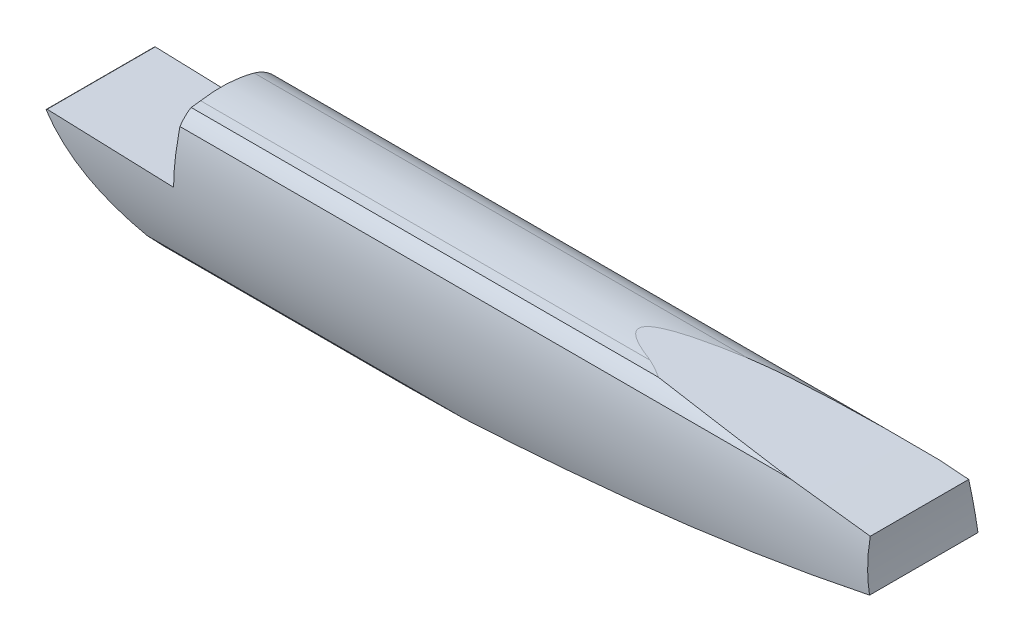
from build123d import *

# Parameters (mm, degrees)
BOSS_EXTRUDE1_DEPTH     = 100
CUT_EXTRUDE3_DEPTH      = 554.165701555
CUT_EXTRUDE3_DEPTH_BACK = 554.165701555
CUT_EXTRUDE5_DEPTH      = 553.962044682
CUT_EXTRUDE5_DEPTH_BACK = 553.962044682
CUT_EXTRUDE7_DEPTH      = 553.962044682
CUT_EXTRUDE7_DEPTH_BACK = 553.962044682


with BuildPart() as part:
    # Sketch1 → Boss-Extrude1 (new body)
    with BuildSketch(Plane.XY):
        with BuildLine():
            ThreePointArc((-192.629438793, 0), (-136.135725272, 33.719619965), (-73.991525193, 55.321722514))
            ThreePointArc((-73.991525193, 55.321722514), (231.264395529, 54.89097703), (535.785554592, 33.719619965))
            ThreePointArc((535.785554592, 33.719619965), (536.798211586, 12.89819156), (539.317827414, -7.795017256))
            ThreePointArc((539.317827414, -7.795017256), (238.042039648, -55.533392614), (-66.568309368, -71.614065728))
            ThreePointArc((-66.568309368, -71.614065728), (-137.800866021, -50.244872094), (-192.629438793, 0))
        make_face()
    extrude(amount=BOSS_EXTRUDE1_DEPTH)

    # Sketch2 → Cut-Extrude3 (cut, two sides: drawn at the far end of the back side and taken through both)
    with BuildSketch(Plane(origin=(0, 0, 0), x_dir=(0, 0, -1), z_dir=(1, 0, 0)).offset(-CUT_EXTRUDE3_DEPTH_BACK)):
        with BuildLine():
            ThreePointArc((-65.447202994, 54.830423707), (-80.892507985, 50.983746932), (-92.956496986, 40.600368972))
            ThreePointArc((-92.956496986, 40.600368972), (-98.736407831, -10.977338679), (-88.967303886, -61.950193259))
            ThreePointArc((-88.967303886, -61.950193259), (-83.10915251, -68.165990231), (-75.589128758, -72.216090516))
            ThreePointArc((-75.589128758, -72.216090516), (-123.822815089, -94.064788666), (-173.378544397, -75.407784602))
            ThreePointArc((-173.378544397, -75.407784602), (-163.802190068, -4.583325871), (-135.262897635, 60.940099743))
            ThreePointArc((-135.262897635, 60.940099743), (-100.366866686, 80.430667917), (-61.326949176, 89.003885783))
            ThreePointArc((-61.326949176, 89.003885783), (-63.560434952, 71.938056418), (-65.447202994, 54.830423707))
        make_face()
    extrude(amount=CUT_EXTRUDE3_DEPTH + CUT_EXTRUDE3_DEPTH_BACK, mode=Mode.SUBTRACT)

    # Sketch3 → Cut-Extrude5 (cut, two sides: drawn at the far end of the back side and taken through both)
    with BuildSketch(Plane(origin=(0, 0, 0), x_dir=(0, 0, -1), z_dir=(1, 0, 0)).offset(-CUT_EXTRUDE5_DEPTH_BACK)):
        with BuildLine():
            ThreePointArc((-74.208303325, 50.886642831), (-50.335012976, 52.211638999), (-26.713093985, 48.511024166))
            ThreePointArc((-26.713093985, 48.511024166), (-16.247111553, 43.841102683), (-7.714956491, 36.189482926))
            ThreePointArc((-7.714956491, 36.189482926), (-2.445034952, -12.786836037), (-8.678058045, -61.649923489))
            ThreePointArc((-8.678058045, -61.649923489), (-17.453523943, -70.69509128), (-29.511303704, -74.360307413))
            ThreePointArc((-29.511303704, -74.360307413), (33.955140221, -79.826327987), (85.286434054, -42.104117568))
            ThreePointArc((85.286434054, -42.104117568), (41.180066923, 16.064388488), (12.319514625, 83.116720583))
            ThreePointArc((12.319514625, 83.116720583), (-170.558095104, 441.821406771), (-74.208303325, 50.886642831))
        make_face()
    extrude(amount=CUT_EXTRUDE5_DEPTH + CUT_EXTRUDE5_DEPTH_BACK, mode=Mode.SUBTRACT)

    # Sketch4 → Cut-Extrude7 (cut, two sides: drawn at the far end of the back side and taken through both)
    with BuildSketch(Plane.XY.offset(-CUT_EXTRUDE7_DEPTH_BACK)):
        Polygon((-79.201401397, 32.882000093), (-79.201401397, -3.122719846), (-222.768125928, 1.814195624), (-233.222282556, 17.110218535), (-80.529357675, 72.456896947), align=None)
    extrude(amount=CUT_EXTRUDE7_DEPTH + CUT_EXTRUDE7_DEPTH_BACK, mode=Mode.SUBTRACT)


solid = part.part
